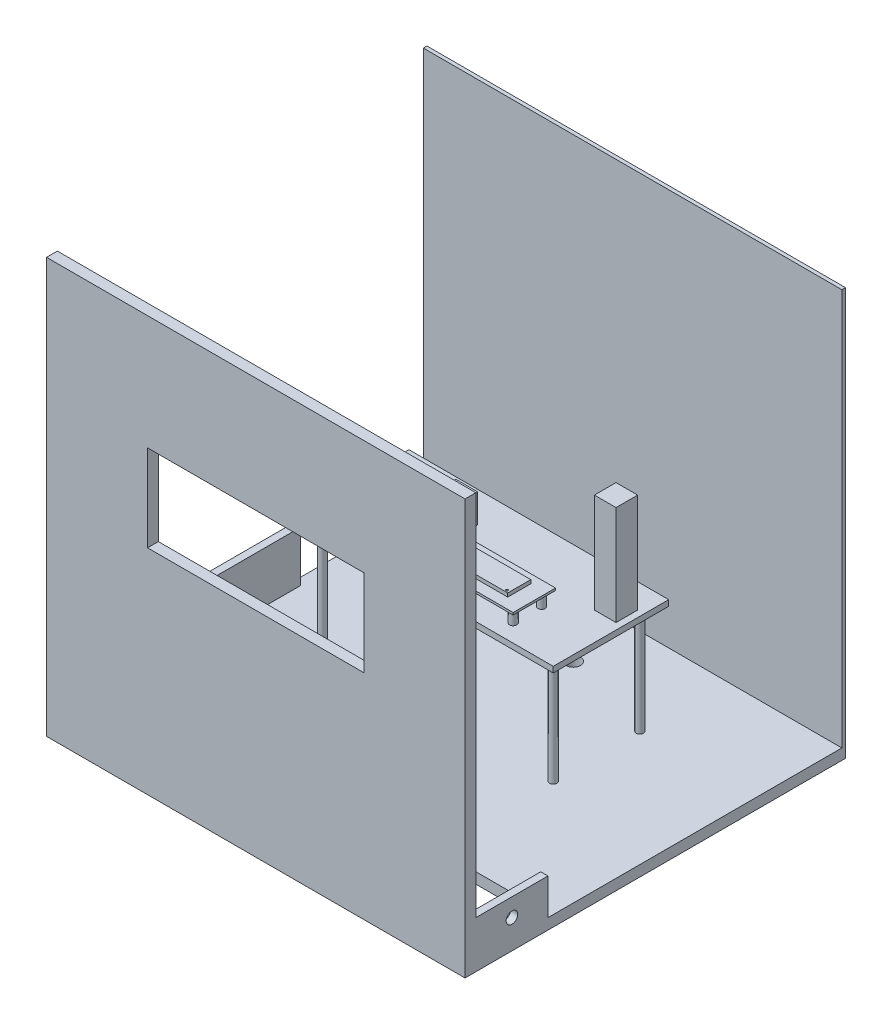
from build123d import *

# Parameters (mm, degrees)
SKETCH_1_W          = 580
SKETCH_1_H          = 560
EXTRUDE_1_DEPTH     = 15
SKETCH_3_W          = 580
SKETCH_3_H          = 500.057079529
EXTRUDE_2_DEPTH     = 15
SKETCH_4_R          = 10
SKETCH_4_W          = 58
SKETCH_4_H          = 70
CUT_EXTRUDE_1_DEPTH = 15
SKETCH_5_W          = 40
SKETCH_5_H          = 40
SKETCH_5_R          = 10
EXTRUDE_3_DEPTH     = 7
SKETCH_6_W          = 100
SKETCH_6_H          = 50
SKETCH_6_R          = 8
EXTRUDE_4_DEPTH     = 10
EXTRUDE_START       = -10
SKETCH_7_W          = 100
SKETCH_7_H          = 50
SKETCH_7_R          = 8
EXTRUDE_5_DEPTH     = 10
SKETCH_8_W          = 580
SKETCH_8_H          = 15
EXTRUDE_6_DEPTH     = 27.2
SKETCH_9_W          = 580
SKETCH_9_H          = 5
EXTRUDE_7_DEPTH     = 550
SKETCH_10_R         = 5
EXTRUDE_8_DEPTH     = 150
SKETCH_11_W         = 360
SKETCH_11_H         = 160
EXTRUDE_9_DEPTH     = 8
SKETCH_12_W         = 30
SKETCH_12_H         = 30
EXTRUDE_10_DEPTH    = 40
SKETCH_13_W         = 30
SKETCH_13_H         = 30
EXTRUDE_11_DEPTH    = 138
SKETCH_14_W         = 127.257079529
SKETCH_14_H         = 70
EXTRUDE_12_DEPTH    = 10
SKETCH_15_R         = 10
SKETCH_15_R_2       = 7
SKETCH_15_R_3       = 2.5
EXTRUDE_13_DEPTH    = 3
FILLET_2_R          = 2
SKETCH_16_R         = 5
EXTRUDE_14_DEPTH    = 20
SKETCH_17_W         = 119.457499099
SKETCH_17_H         = 58.776896967
EXTRUDE_15_DEPTH    = 3
SKETCH_18_W         = 78.016217291
SKETCH_18_H         = 31.996524559
SKETCH_18_R         = 1.406019753
SKETCH_18_R_2       = 1.53736257
SKETCH_18_R_3       = 1.499754403
EXTRUDE_16_DEPTH    = 5


with BuildPart() as part:
    # 草图1 → 凸台-拉伸1 (new body)
    with BuildSketch(Plane.XY):
        with Locations((200, 280)):
            Rectangle(SKETCH_1_W, SKETCH_1_H)
        Polygon((200, 401.320557861), (350, 401.320557861), (350, 281.320557861), (50, 281.320557861), (50, 401.320557861), align=None, mode=Mode.SUBTRACT)
    extrude(amount=EXTRUDE_1_DEPTH)



with BuildPart() as body_2:
    # 草图3 → 凸台-拉伸2 (new body)
    with BuildSketch(Plane.XZ):
        with Locations((200, -235.028539765)):
            Rectangle(SKETCH_3_W, SKETCH_3_H)
    extrude(amount=EXTRUDE_2_DEPTH)

    # 草图4 → 切除-拉伸1 (cut)
    with BuildSketch(Plane.XZ.offset(15)):
        with Locations(Location((200, -425.057079529, 0), (0, 0, 270))):
            Circle(SKETCH_4_R)
        with Locations((409, -70.057079529)):
            Rectangle(SKETCH_4_W, SKETCH_4_H)
        with Locations((-9, -70.057079529)):
            Rectangle(SKETCH_4_W, SKETCH_4_H)
    extrude(amount=-CUT_EXTRUDE_1_DEPTH, mode=Mode.SUBTRACT)

    # 草图5 → 凸台-拉伸3 (add)
    with BuildSketch(Plane.XZ.offset(15)):
        with Locations((200, -425.057079529)):
            Rectangle(SKETCH_5_W, SKETCH_5_H)
        with Locations(Location((200, -425.057079529, 0), (0, 0, 270))):
            Circle(SKETCH_5_R, mode=Mode.SUBTRACT)
    extrude(amount=EXTRUDE_3_DEPTH)


with BuildPart() as part_1:
    add(part.part)

    add(body_2.part)  # 凸台-拉伸4 merges body 2
    # 草图6 → 凸台-拉伸4 (add)
    with BuildSketch(Plane.ZY.offset(90)):
        with Locations((-50, 25)):
            Rectangle(SKETCH_6_W, SKETCH_6_H)
        with Locations((-50, 25)):
            Circle(SKETCH_6_R, mode=Mode.SUBTRACT)
    extrude(amount=-EXTRUDE_4_DEPTH)

    # 草图7 → 凸台-拉伸5 (add)
    with BuildSketch(Plane(origin=(490, 0, 0), x_dir=(0, 0, -1), z_dir=(1, 0, 0)).offset(EXTRUDE_START)):
        with Locations((50, 25)):
            Rectangle(SKETCH_7_W, SKETCH_7_H)
        with Locations(Location((50, 25, 0), (0, 0, 180))):
            Circle(SKETCH_7_R, mode=Mode.SUBTRACT)
    extrude(amount=EXTRUDE_5_DEPTH)

    # 草图8 → 凸台-拉伸6 (add)
    with BuildSketch(Plane(origin=(0, 0, -485.057079529), x_dir=(-1, 0, 0), z_dir=(0, 0, -1))):
        with Locations((-200, -7.5)):
            Rectangle(SKETCH_8_W, SKETCH_8_H)
    extrude(amount=EXTRUDE_6_DEPTH)

    # 草图9 → 凸台-拉伸7 (add)
    with BuildSketch(Plane(origin=(0, 0, 0), x_dir=(1, 0, 0), z_dir=(0, 1, 0))):
        with Locations((200, 509.757079529)):
            Rectangle(SKETCH_9_W, SKETCH_9_H)
    extrude(amount=EXTRUDE_7_DEPTH)

    # 草图10 → 凸台-拉伸8 (add)
    with BuildSketch(Plane(origin=(0, 0, 0), x_dir=(1, 0, 0), z_dir=(0, 1, 0))):
        with Locations(Location((10, 387.257079529, 0), (0, 0, 270))):
            Circle(SKETCH_10_R)
        with Locations(Location((330, 387.257079529, 0), (0, 0, 270))):
            Circle(SKETCH_10_R)
        with Locations(Location((10, 267.257079529, 0), (0, 0, 270))):
            Circle(SKETCH_10_R)
        with Locations(Location((330, 267.257079529, 0), (0, 0, 270))):
            Circle(SKETCH_10_R)
    extrude(amount=EXTRUDE_8_DEPTH)

    # 草图11 → 凸台-拉伸9 (add)
    with BuildSketch(Plane(origin=(0, 150, 0), x_dir=(1, 0, 0), z_dir=(0, 1, 0))):
        with Locations((170, 327.257079529)):
            Rectangle(SKETCH_11_W, SKETCH_11_H)
    extrude(amount=EXTRUDE_9_DEPTH)

    # 草图12 → 凸台-拉伸10 (add)
    with BuildSketch(Plane(origin=(0, 158, 0), x_dir=(1, 0, 0), z_dir=(0, 1, 0))):
        with Locations((113, 349.257079529)):
            Rectangle(SKETCH_12_W, SKETCH_12_H)
    extrude(amount=EXTRUDE_10_DEPTH)

    # 草图13 → 凸台-拉伸11 (add)
    with BuildSketch(Plane(origin=(0, 158, 0), x_dir=(1, 0, 0), z_dir=(0, 1, 0))):
        with Locations((326, 358.257079529)):
            Rectangle(SKETCH_13_W, SKETCH_13_H)
    extrude(amount=EXTRUDE_11_DEPTH)

    # 草图14 → 凸台-拉伸12 (add)
    with BuildSketch(Plane.ZY.offset(90)):
        with Locations((-263.628539765, 35)):
            Rectangle(SKETCH_14_W, SKETCH_14_H)
    extrude(amount=-EXTRUDE_12_DEPTH)

    # 草图15 → 凸台-拉伸13 (add)
    # profile 1 of 2: a face of its own
    with BuildSketch(Plane.ZY.offset(90)):
        with Locations(Location((-263.628539764, 35, 0), (0, 0, 180))):
            Circle(SKETCH_15_R)
        with Locations((-263.628539764, 35)):
            Circle(SKETCH_15_R_2, mode=Mode.SUBTRACT)
    # profile 2 of 2: a face of its own
    with BuildSketch(Plane.ZY.offset(90)):
        with Locations(Location((-263.628539764, 35, 0), (0, 0, 180))):
            Circle(SKETCH_15_R_3)
    extrude(amount=EXTRUDE_13_DEPTH)

    # 圆角2
    fillet_2_edges = [part_1.edges().sort_by_distance(p)[0] for p in [
        (-93, 35, -253.628539764),
        (-93, 35, -261.128539764),
    ]]
    fillet(fillet_2_edges, radius=FILLET_2_R)

    # 草图16 → 凸台-拉伸14 (add)
    with BuildSketch(Plane(origin=(0, 158, 0), x_dir=(1, 0, 0), z_dir=(0, 1, 0))):
        with Locations(Location((171.790204926, 271.64043121, 0), (0, 0, 270))):
            Circle(SKETCH_16_R)
        with Locations(Location((270.129191609, 271.64043121, 0), (0, 0, 270))):
            Circle(SKETCH_16_R)
        with Locations(Location((171.790204926, 310.918685367, 0), (0, 0, 270))):
            Circle(SKETCH_16_R)
        with Locations(Location((270.129191609, 310.918685367, 0), (0, 0, 270))):
            Circle(SKETCH_16_R)
    extrude(amount=EXTRUDE_14_DEPTH)

    # 草图17 → 凸台-拉伸15 (add)
    with BuildSketch(Plane(origin=(0, 178, 0), x_dir=(1, 0, 0), z_dir=(0, 1, 0))):
        with Locations((220.921909881, 290.395031068)):
            Rectangle(SKETCH_17_W, SKETCH_17_H)
    extrude(amount=EXTRUDE_15_DEPTH)

    # 草图18 → 凸台-拉伸16 (add)
    with BuildSketch(Plane(origin=(0, 181, 0), x_dir=(1, 0, 0), z_dir=(0, 1, 0))):
        with Locations((219.405209005, 291.746230642)):
            Rectangle(SKETCH_18_W, SKETCH_18_H)
        with Locations(Location((184.299854938, 304.10663833, 0), (0, 0, 270))):
            Circle(SKETCH_18_R, mode=Mode.SUBTRACT)
        with Locations(Location((184.299854938, 278.517078822, 0), (0, 0, 270))):
            Circle(SKETCH_18_R_2, mode=Mode.SUBTRACT)
        with Locations(Location((254.507107947, 278.517078822, 0), (0, 0, 270))):
            Circle(SKETCH_18_R_3, mode=Mode.SUBTRACT)
    extrude(amount=EXTRUDE_16_DEPTH)


solid = part_1.part
